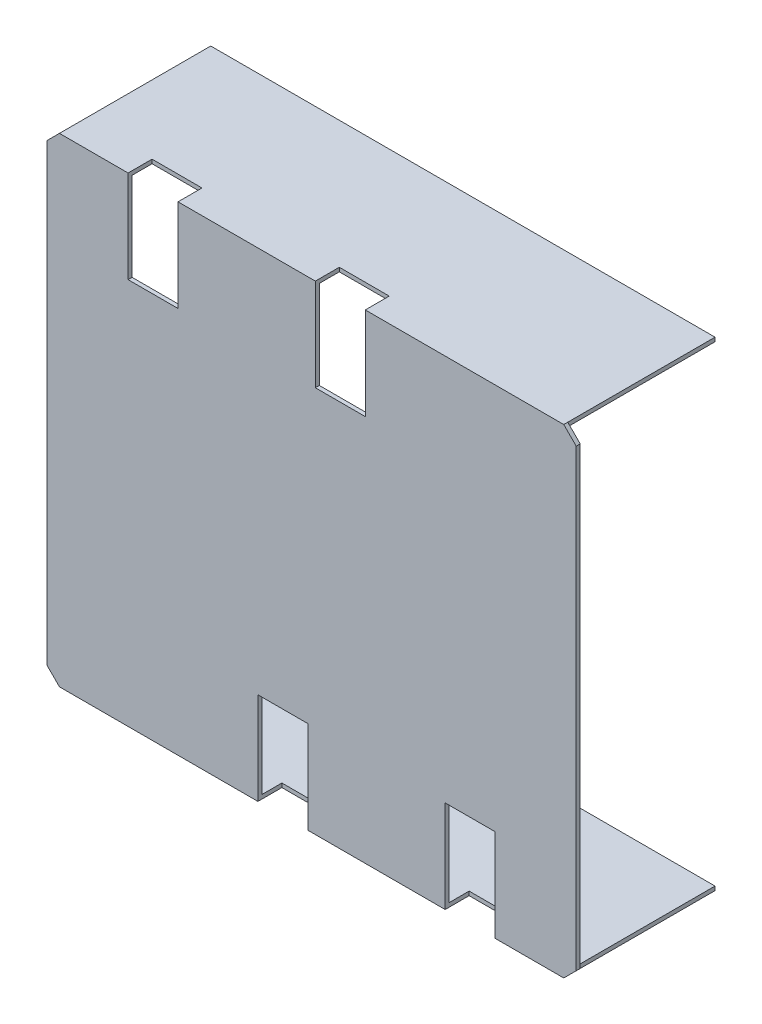
from build123d import *

# Parameters (mm, degrees)
F_5052_START                               = 86
F_5052_SHEET_TOP_PANEL_DEPTH               = 1.6
FOLDED_START                               = 27
SKETCH2_W                                  = 202
SKETCH2_H                                  = 1.6
FOLDED_SIDE_SKIRTS_WITH_OPEN_ENDS_DEPTH    = 59
FOUR_START                                 = 78
SKETCH3_W                                  = 20
SKETCH3_H                                  = 38
FOUR_SIDE_OPEN_HOSE_AND_WRENCH_SLOTS_DEPTH = 9.6


with BuildPart() as part:
    # Sketch1 → 5052 sheet top panel (new body)
    with BuildSketch(Plane.XY.offset(F_5052_START)):
        Polygon((-101, -96), (101, -96), (106, -91), (106, 91), (101, 96), (-101, 96), (-106, 91), (-106, -91), align=None)
    extrude(amount=F_5052_SHEET_TOP_PANEL_DEPTH)

    # Sketch2 → Folded side skirts with open ends (add)
    with BuildSketch(Plane.XY.offset(FOLDED_START)):
        with Locations((0, 95.2)):
            Rectangle(SKETCH2_W, SKETCH2_H)
        with Locations((0, -95.2)):
            Rectangle(SKETCH2_W, SKETCH2_H)
    extrude(amount=FOLDED_SIDE_SKIRTS_WITH_OPEN_ENDS_DEPTH)

    # Sketch3 → Four side-open hose and wrench slots (cut)
    with BuildSketch(Plane.XY.offset(FOUR_START)):
        with Locations((-63.5, 78)):
            Rectangle(SKETCH3_W, SKETCH3_H)
        with Locations((63.5, -78)):
            Rectangle(SKETCH3_W, SKETCH3_H)
        with Locations((11.5, 78)):
            Rectangle(SKETCH3_W, SKETCH3_H)
        with Locations((-11.5, -78)):
            Rectangle(SKETCH3_W, SKETCH3_H)
    extrude(amount=FOUR_SIDE_OPEN_HOSE_AND_WRENCH_SLOTS_DEPTH, mode=Mode.SUBTRACT)


solid = part.part
